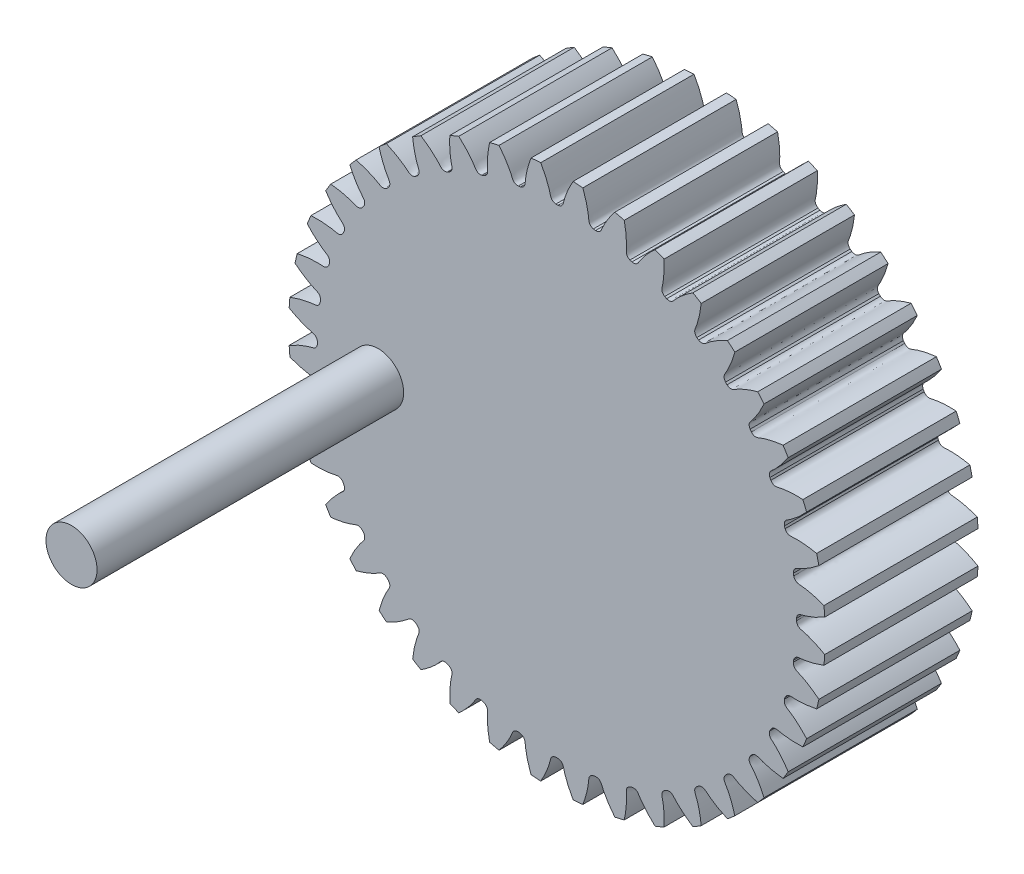
from build123d import *

# Parameters (mm, degrees)
SKETCH_1_R               = 52.5
EXTRUDE_1_DEPTH          = 30
CUT_EXTRUDE_1_DEPTH      = 81.07808689
PATTERN_CIRCULAR_1_COUNT = 40
SKETCH_5_R               = 5
EXTRUDE_2_DEPTH          = 60


with BuildPart() as part:
    # 草图1 → 凸台-拉伸1 (new body)
    with BuildSketch(Plane.XY):
        Circle(SKETCH_1_R)
    extrude(amount=EXTRUDE_1_DEPTH)

    # 草图2 → 切除-拉伸1 (cut, through all)
    with BuildSketch(Plane.XY):
        with BuildLine():
            ThreePointArc((0.211477199, 46.874522956), (0, 46.875), (-0.211477199, 46.874522956))
            add(Edge.make_bspline(
                [(-0.211477199, 46.874522956), (-1.139162597, 47.010122741), (-1.223726032, 47.676213689), (-1.417429212, 48.390484542), (-1.484807214, 48.623163604), (-1.562598915, 48.872298125), (-1.651253069, 49.137683361), (-1.751518318, 49.418939763), (-1.864041669, 49.715713136), (-1.989487307, 50.027615373), (-2.12850076, 50.354242311), (-2.281718732, 50.695168831), (-2.449765538, 51.04995066), (-2.633253466, 51.418124234), (-2.832782, 51.799207134), (-3.04893739, 52.19269838), (-3.282292126, 52.598078783), (-3.533404451, 53.014811289), (-3.80281788, 53.442341349), (-4.09106072, 53.880097295), (-4.398645608, 54.327490728), (-4.726069052, 54.783916917), (-5.073810987, 55.248755216), (-5.442334339, 55.721369484), (-5.832084594, 56.201108519), (-6.243489392, 56.687306506), (-6.676958104, 57.179283471), (-7.132881493, 57.676345747), (-7.61163114, 58.177786454), (-8.289701364, 58.860140274), (-8.820471181, 59.362761161), (-9.185333357, 59.695033948)],
                knots=[0, 0, 0, 0, 0.110656833, 0.124738805, 0.140005423, 0.156456686, 0.174092594, 0.192913148, 0.212918347, 0.234108191, 0.25648268, 0.280041814, 0.304785594, 0.330714019, 0.357827089, 0.386124804, 0.415607165, 0.446274171, 0.478125822, 0.511162118, 0.545383059, 0.580788646, 0.617378878, 0.655153755, 0.694113277, 0.734257445, 0.775586258, 0.818099716, 0.861797819, 0.906680567, 1, 1, 1, 1], degree=3))
            ThreePointArc((-9.185333357, 59.695033948), (0, 60.397577989), (9.185333357, 59.695033948))
            add(Edge.make_bspline(
                [(0.211477199, 46.874522956), (1.139162597, 47.010122741), (1.223726032, 47.676213689), (1.417429212, 48.390484542), (1.484807214, 48.623163604), (1.562598915, 48.872298125), (1.651253069, 49.137683361), (1.751518318, 49.418939763), (1.864041669, 49.715713136), (1.989487307, 50.027615373), (2.12850076, 50.354242311), (2.281718732, 50.695168831), (2.449765538, 51.04995066), (2.633253466, 51.418124234), (2.832782, 51.799207134), (3.04893739, 52.19269838), (3.282292126, 52.598078783), (3.533404451, 53.014811289), (3.80281788, 53.442341349), (4.09106072, 53.880097295), (4.398645608, 54.327490728), (4.726069052, 54.783916917), (5.073810987, 55.248755216), (5.442334339, 55.721369484), (5.832084594, 56.201108519), (6.243489392, 56.687306506), (6.676958104, 57.179283471), (7.132881493, 57.676345747), (7.61163114, 58.177786454), (8.289701364, 58.860140274), (8.820471181, 59.362761161), (9.185333357, 59.695033948)],
                knots=[0, 0, 0, 0, 0.110656833, 0.124738805, 0.140005423, 0.156456686, 0.174092594, 0.192913148, 0.212918347, 0.234108191, 0.25648268, 0.280041814, 0.304785594, 0.330714019, 0.357827089, 0.386124804, 0.415607165, 0.446274171, 0.478125822, 0.511162118, 0.545383059, 0.580788646, 0.617378878, 0.655153755, 0.694113277, 0.734257445, 0.775586258, 0.818099716, 0.861797819, 0.906680567, 1, 1, 1, 1], degree=3))
        make_face()
    cut_extrude_1 = extrude(amount=CUT_EXTRUDE_1_DEPTH, mode=Mode.SUBTRACT)

    # 阵列(圆周)1: 切除-拉伸1 ×40 about axis
    pattern_circular_1_axis = Axis((0, 0, 30), (0, 0, -1))
    for i in range(1, PATTERN_CIRCULAR_1_COUNT):
        add(cut_extrude_1.rotate(pattern_circular_1_axis, i * 360 / PATTERN_CIRCULAR_1_COUNT), mode=Mode.SUBTRACT)

    # 草图5 → 凸台-拉伸2 (add)
    with BuildSketch(Plane.XY.offset(30)):
        with Locations((-35, 0)):
            Circle(SKETCH_5_R)
    extrude(amount=EXTRUDE_2_DEPTH)


solid = part.part
